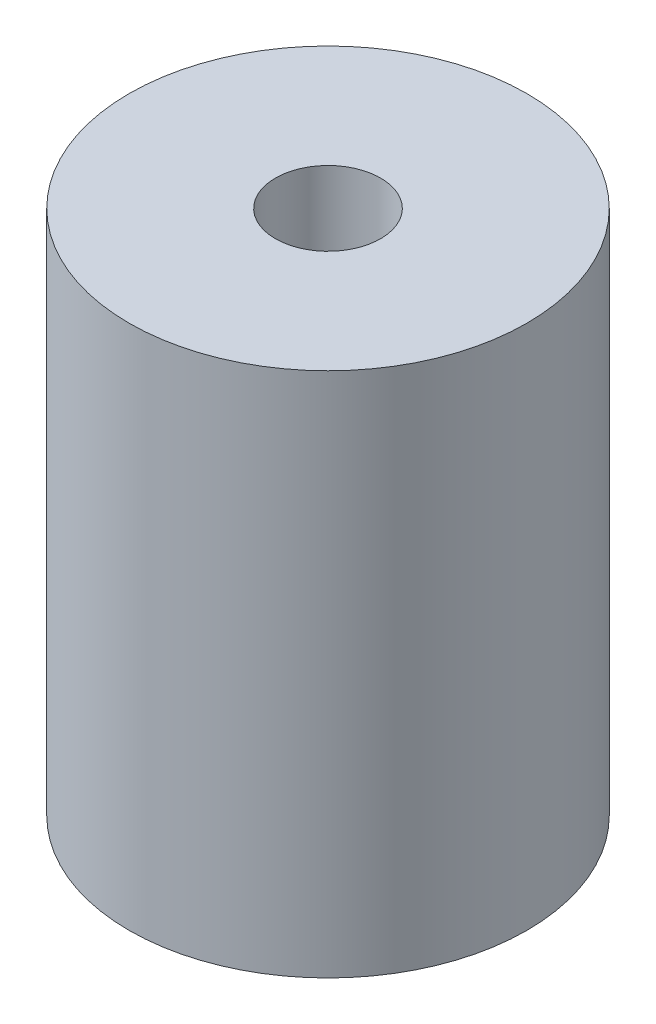
from build123d import *

# Parameters (mm, degrees)
SKETCH1_R           = 9.455
SKETCH1_R_2         = 2.5
BOSS_EXTRUDE1_DEPTH = 25
BOSS_EXTRUDE2_START = -18
SKETCH2_R           = 2.5
BOSS_EXTRUDE2_DEPTH = 11


with BuildPart() as part:
    # Sketch1 → Boss-Extrude1 (new body)
    with BuildSketch(Plane(origin=(0, 0, 0), x_dir=(1, 0, 0), z_dir=(0, 1, 0))):
        with Locations(Location((0, 0, 0), (0, 0, 270))):
            Circle(SKETCH1_R)
        with Locations(Location((0, 0, 0), (0, 0, 270))):
            Circle(SKETCH1_R_2, mode=Mode.SUBTRACT)
    extrude(amount=BOSS_EXTRUDE1_DEPTH)

    # Sketch2 → Boss-Extrude2 (add)
    with BuildSketch(Plane(origin=(0, 25, 0), x_dir=(1, 0, 0), z_dir=(0, 1, 0)).offset(BOSS_EXTRUDE2_START)):
        with Locations(Location((0, 0, 0), (0, 0, 270))):
            Circle(SKETCH2_R)
    extrude(amount=BOSS_EXTRUDE2_DEPTH)


solid = part.part
